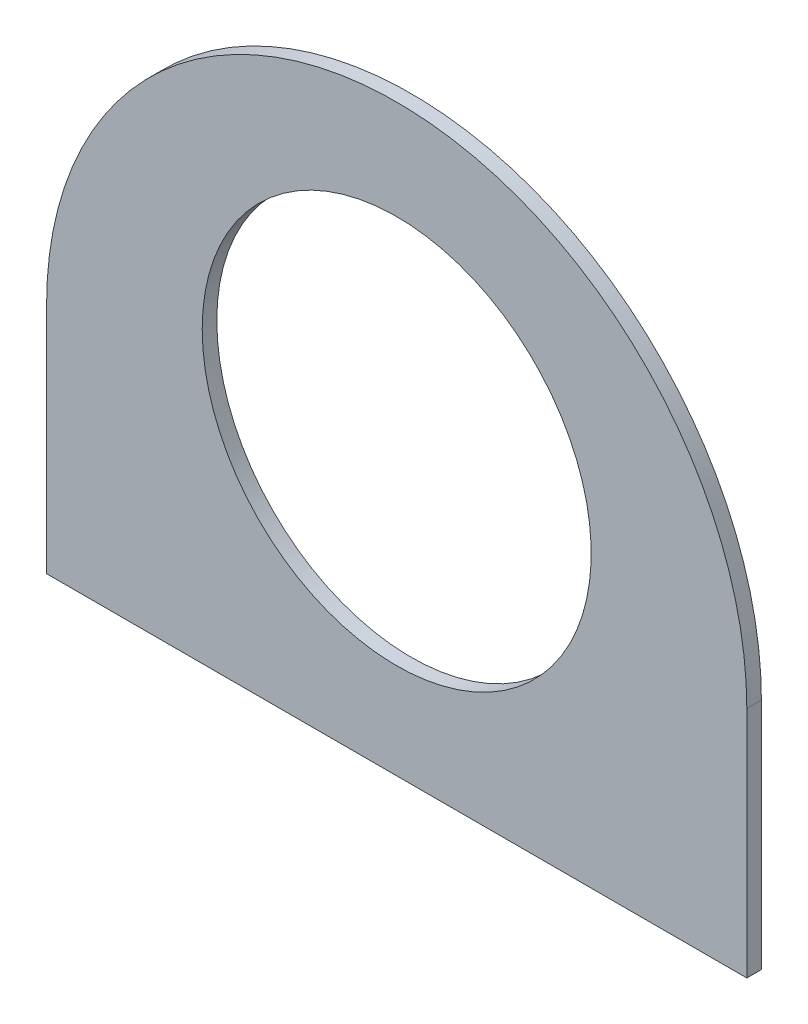
from build123d import *

# Parameters (mm, degrees)
SKETCH1_R           = 127
BOSS_EXTRUDE1_DEPTH = 9.525


with BuildPart() as part:
    # Sketch1 → Boss-Extrude1 (new body)
    with BuildSketch(Plane.XY):
        with BuildLine():
            Line((-228.6, -36.83), (-228.6, -189.23))
            Line((-228.6, -189.23), (228.6, -189.23))
            Line((228.6, -189.23), (228.6, -36.83))
            ThreePointArc((228.6, -36.83), (0, 191.77), (-228.6, -36.83))
        make_face()
        with Locations(Location((0, 0, 0), (0, 0, 180))):
            Circle(SKETCH1_R, mode=Mode.SUBTRACT)
    extrude(amount=BOSS_EXTRUDE1_DEPTH)


solid = part.part
